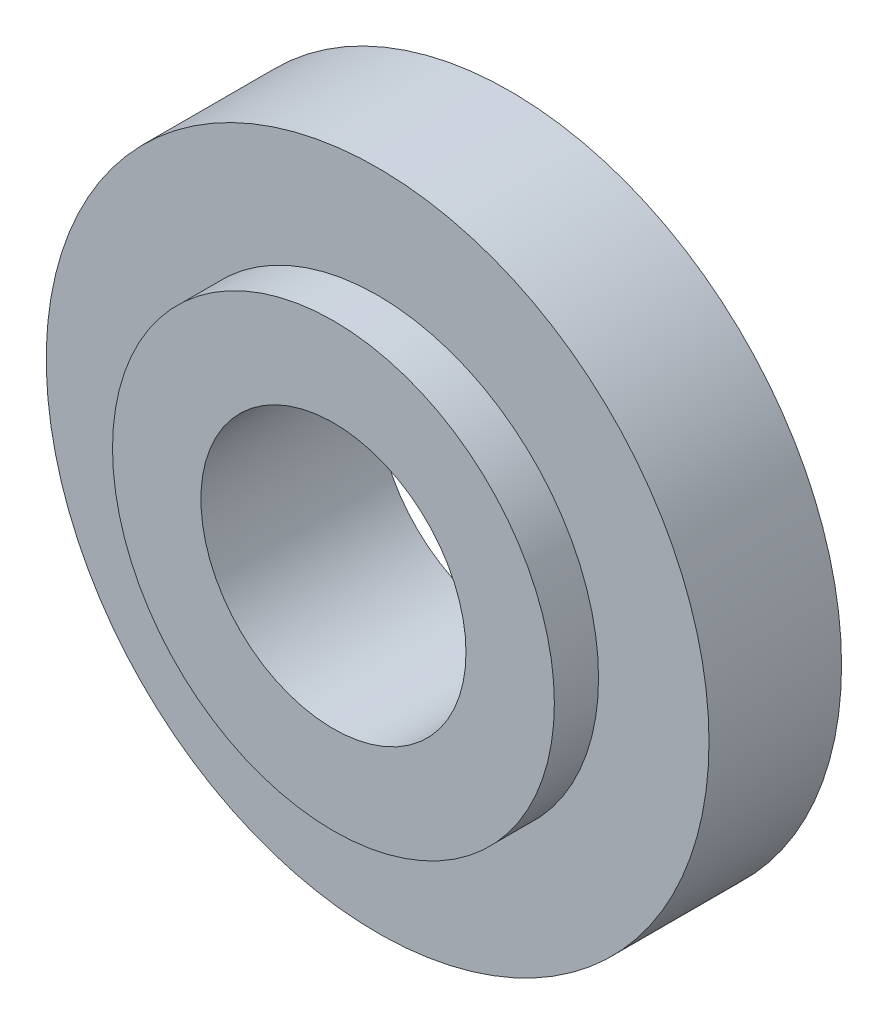
from build123d import *

# Parameters (mm, degrees)
SKETCH1_R           = 3.75
SKETCH1_R_2         = 1.5
BOSS_EXTRUDE1_DEPTH = 1.5
SKETCH2_R           = 2.5
SKETCH2_R_2         = 1.5
BOSS_EXTRUDE2_DEPTH = 0.5


with BuildPart() as part:
    # Sketch1 → Boss-Extrude1 (new body)
    with BuildSketch(Plane.XY):
        Circle(SKETCH1_R)
        Circle(SKETCH1_R_2, mode=Mode.SUBTRACT)
    extrude(amount=BOSS_EXTRUDE1_DEPTH)

    # Sketch2 → Boss-Extrude2 (add)
    with BuildSketch(Plane.XY.offset(1.5)):
        Circle(SKETCH2_R)
        Circle(SKETCH2_R_2, mode=Mode.SUBTRACT)
    extrude(amount=BOSS_EXTRUDE2_DEPTH)


solid = part.part
